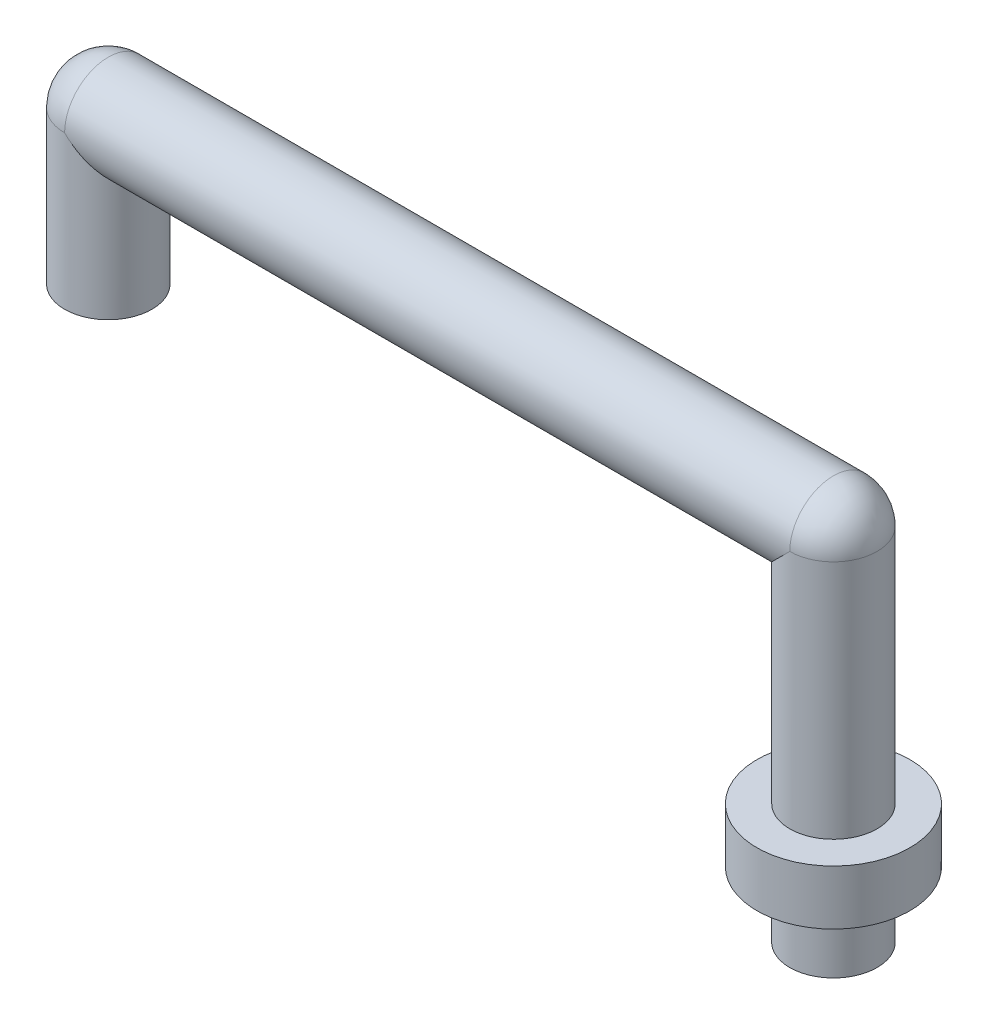
from build123d import *

# Parameters (mm, degrees)
SKETCH2_R           = 5.08
BOSS_EXTRUDE2_DEPTH = 41.91
SKETCH3_W           = 8.89
SKETCH3_H           = 6.35


with BuildPart() as part:
    # Sketch2 → Boss-Extrude2 (new body)
    with BuildSketch(Plane(origin=(0, 0, 0), x_dir=(-1, 0, 0), z_dir=(0, 1, 0))):
        with Locations(Location((0, 0, 0), (0, 0, 90))):
            Circle(SKETCH2_R)
    extrude(amount=BOSS_EXTRUDE2_DEPTH)

    # Sketch3 → Revolve1 (revolve)
    with BuildSketch(Plane.XY, mode=Mode.PRIVATE) as revolve1_sk:
        with Locations((-4.445, 10.795)):
            Rectangle(SKETCH3_W, SKETCH3_H)
    revolve(revolve1_sk.sketch.rotate(Axis((0, 0, 0), (0, 1, 0)), 270), axis=Axis((0, 0, 0), (0, 1, 0)))

    # Sketch4 → Revolve2 (revolve)
    with BuildSketch(Plane(origin=(0, 41.91, 0), x_dir=(1, 0, 0), z_dir=(0, 1, 0)), mode=Mode.PRIVATE) as revolve2_sk:
        with BuildLine():
            Line((0, 5.08), (-84.328, 5.08))
            Line((-84.328, 5.08), (-84.328, 0))
            Line((-84.328, 0), (5.08, 0))
            ThreePointArc((5.08, 0), (3.592102448, 3.592102448), (0, 5.08))
        make_face()
    revolve(revolve2_sk.sketch.rotate(Axis((-84.328, 41.91, 0), (1, 0, 0)), 180), axis=Axis((-84.328, 41.91, 0), (1, 0, 0)))

    # Sketch5 → Revolve3 (revolve)
    with BuildSketch(Plane.ZY.offset(84.328), mode=Mode.PRIVATE) as revolve3_sk:
        with BuildLine():
            Line((0, 46.99), (0, 24.13))
            Line((0, 24.13), (-5.08, 24.13))
            Line((-5.08, 24.13), (-5.08, 41.91))
            ThreePointArc((-5.08, 41.91), (-3.592102448, 45.502102448), (0, 46.99))
        make_face()
    revolve(revolve3_sk.sketch.rotate(Axis((-84.328, 46.99, 0), (0, -1, 0)), 180), axis=Axis((-84.328, 46.99, 0), (0, -1, 0)))


solid = part.part
